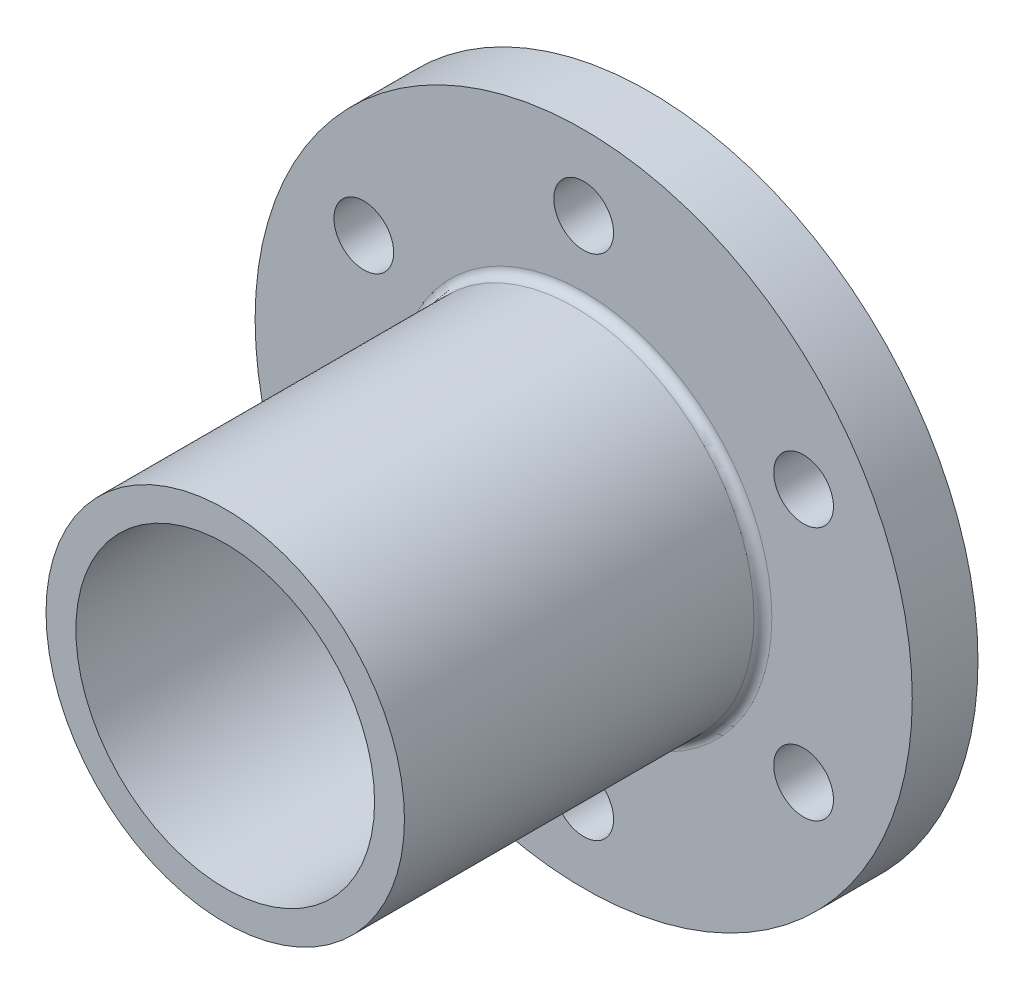
from build123d import *

# Parameters (mm, degrees)
SKETCH2_R           = 110
BOSS_EXTRUDE1_DEPTH = 22
SKETCH3_R           = 60
BOSS_EXTRUDE2_DEPTH = 120
SKETCH4_R           = 50
CUT_EXTRUDE1_DEPTH  = 207
SKETCH5_R           = 10
CUT_EXTRUDE2_DEPTH  = 197.468827044
FILLET1_R           = 3


with BuildPart() as part:
    # Sketch2 → Boss-Extrude1 (new body)
    with BuildSketch(Plane.XY):
        Circle(SKETCH2_R)
    extrude(amount=BOSS_EXTRUDE1_DEPTH)

    # Sketch3 → Boss-Extrude2 (add)
    with BuildSketch(Plane.XY.offset(22)):
        Circle(SKETCH3_R)
    extrude(amount=BOSS_EXTRUDE2_DEPTH)

    # Sketch4 → Cut-Extrude1 (cut)
    with BuildSketch(Plane.XY.offset(142)):
        Circle(SKETCH4_R)
    extrude(amount=-CUT_EXTRUDE1_DEPTH, mode=Mode.SUBTRACT)

    # Sketch5 → Cut-Extrude2 (cut, through all)
    with BuildSketch(Plane.XY.offset(22)):
        with Locations((0, 85)):
            Circle(SKETCH5_R)
        with Locations((73.612159322, 42.5)):
            Circle(SKETCH5_R)
        with Locations((73.612159322, -42.5)):
            Circle(SKETCH5_R)
        with Locations((0, -85)):
            Circle(SKETCH5_R)
        with Locations((-73.612159322, -42.5)):
            Circle(SKETCH5_R)
        with Locations((-73.612159322, 42.5)):
            Circle(SKETCH5_R)
    extrude(amount=-CUT_EXTRUDE2_DEPTH, mode=Mode.SUBTRACT)

    # Fillet1
    fillet1_edges = [part.edges().sort_by_distance(p)[0] for p in [
        (-60, 0, 22),
    ]]
    fillet(fillet1_edges, radius=FILLET1_R)


solid = part.part
